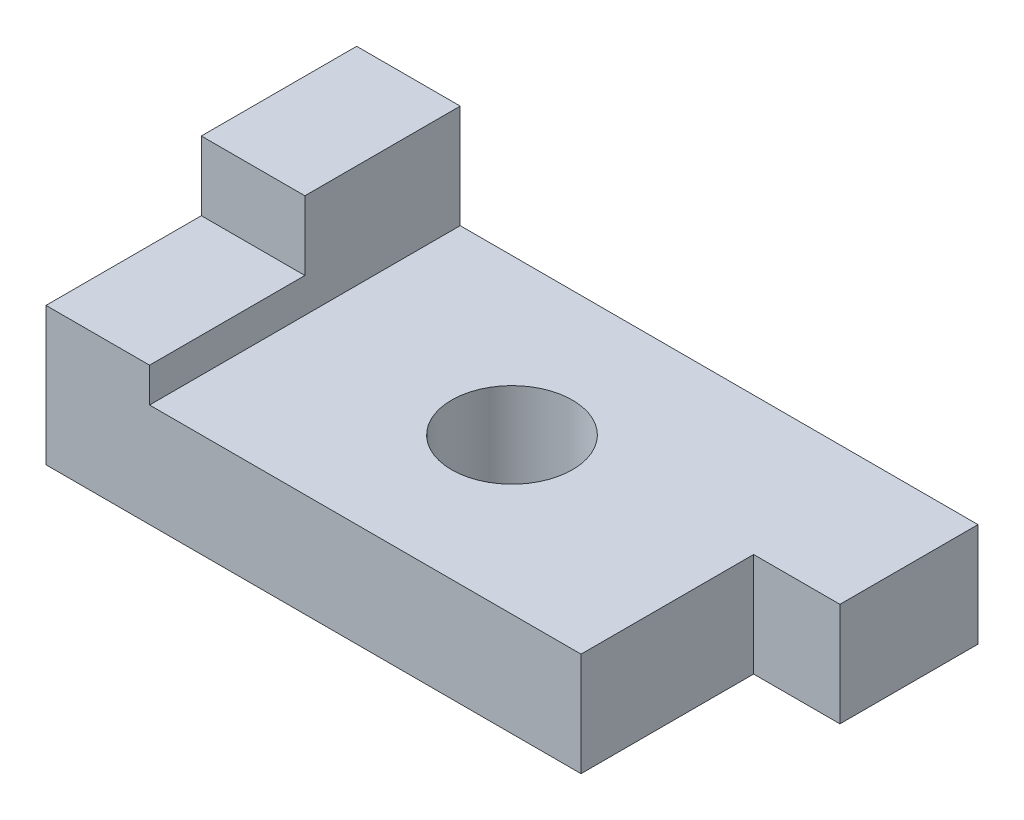
from build123d import *

# Parameters (mm, degrees)
SKETCH_1_R      = 7
EXTRUDE_1_DEPTH = 12
SKETCH_2_W      = 12
SKETCH_2_H      = 18
EXTRUDE_2_DEPTH = 4
SKETCH_3_W      = 12
SKETCH_3_H      = 18
EXTRUDE_3_DEPTH = 12


with BuildPart() as part:
    # 草圖1 → 填料-伸長1 (new body)
    with BuildSketch(Plane(origin=(0, 0, 0), x_dir=(1, 0, 0), z_dir=(0, 1, 0))):
        Polygon((0, 0), (62, 0), (62, 20), (72, 20), (72, 36), (0, 36), align=None)
        with Locations(Location((36, 18, 0), (0, 0, 270))):
            Circle(SKETCH_1_R, mode=Mode.SUBTRACT)
    extrude(amount=EXTRUDE_1_DEPTH)

    # 草圖2 → 填料-伸長2 (add)
    with BuildSketch(Plane(origin=(0, 12, 0), x_dir=(1, 0, 0), z_dir=(0, 1, 0))):
        with Locations((6, 9)):
            Rectangle(SKETCH_2_W, SKETCH_2_H)
    extrude(amount=EXTRUDE_2_DEPTH)

    # 草圖3 → 填料-伸長3 (add)
    with BuildSketch(Plane(origin=(0, 12, 0), x_dir=(1, 0, 0), z_dir=(0, 1, 0))):
        with Locations((6, 27)):
            Rectangle(SKETCH_3_W, SKETCH_3_H)
    extrude(amount=EXTRUDE_3_DEPTH)


solid = part.part
